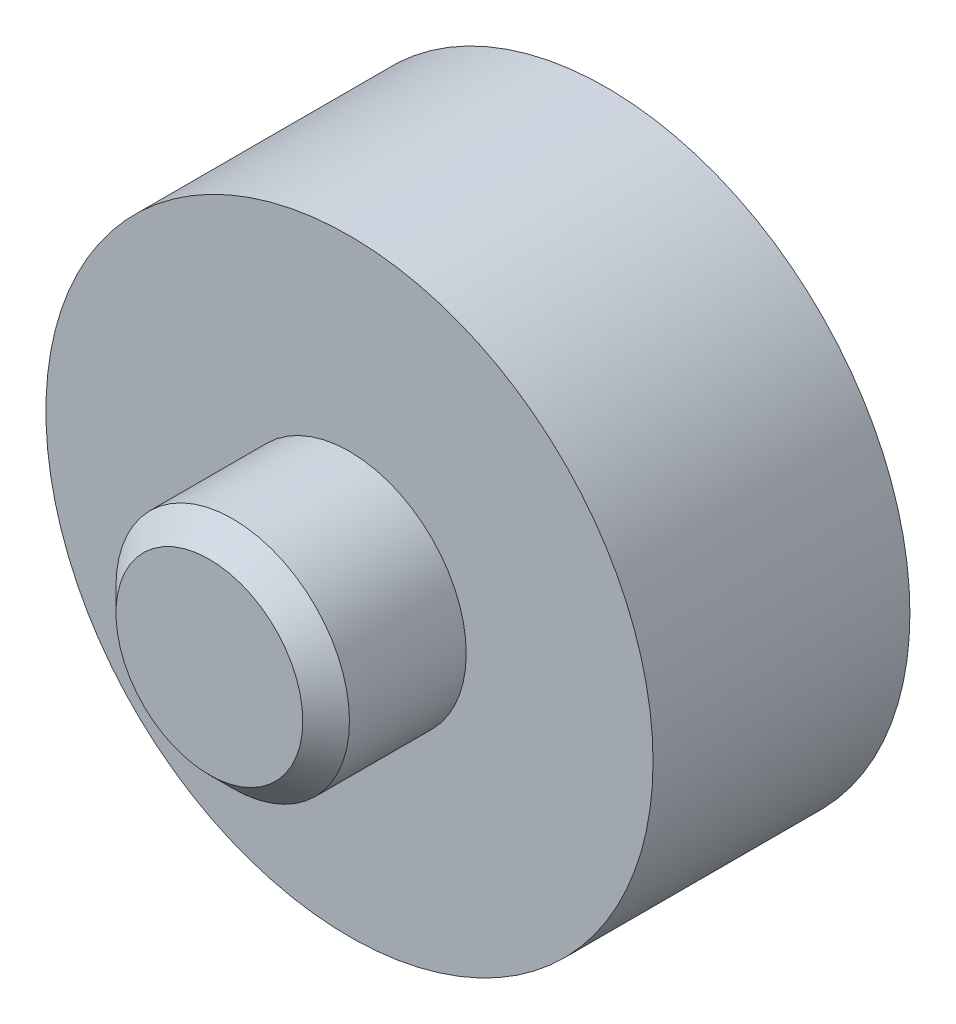
from build123d import *

# Parameters (mm, degrees)
ESQUISSE1_R        = 6.5
ESQUISSE1_R_2      = 2.75
BOSS_EXTRU_1_DEPTH = 3.5
ESQUISSE2_R        = 6.5
BOSS_EXTRU_2_DEPTH = 2
ESQUISSE3_R        = 2.5
BOSS_EXTRU_3_DEPTH = 3
CHANFREIN1_SIZE    = 0.5


with BuildPart() as part:
    # Esquisse1 → Boss.-Extru.1 (new body)
    with BuildSketch(Plane.XY):
        Circle(ESQUISSE1_R)
        Circle(ESQUISSE1_R_2, mode=Mode.SUBTRACT)
    extrude(amount=BOSS_EXTRU_1_DEPTH)

    # Esquisse2 → Boss.-Extru.2 (add)
    with BuildSketch(Plane.XY.offset(3.5)):
        Circle(ESQUISSE2_R)
    extrude(amount=BOSS_EXTRU_2_DEPTH)

    # Esquisse3 → Boss.-Extru.3 (add)
    with BuildSketch(Plane.XY.offset(5.5)):
        Circle(ESQUISSE3_R)
    extrude(amount=BOSS_EXTRU_3_DEPTH)

    # Chanfrein1
    chanfrein1_edges = [part.edges().sort_by_distance(p)[0] for p in [
        (-2.5, 0, 8.5),
    ]]
    chamfer(chanfrein1_edges, length=CHANFREIN1_SIZE)


solid = part.part
